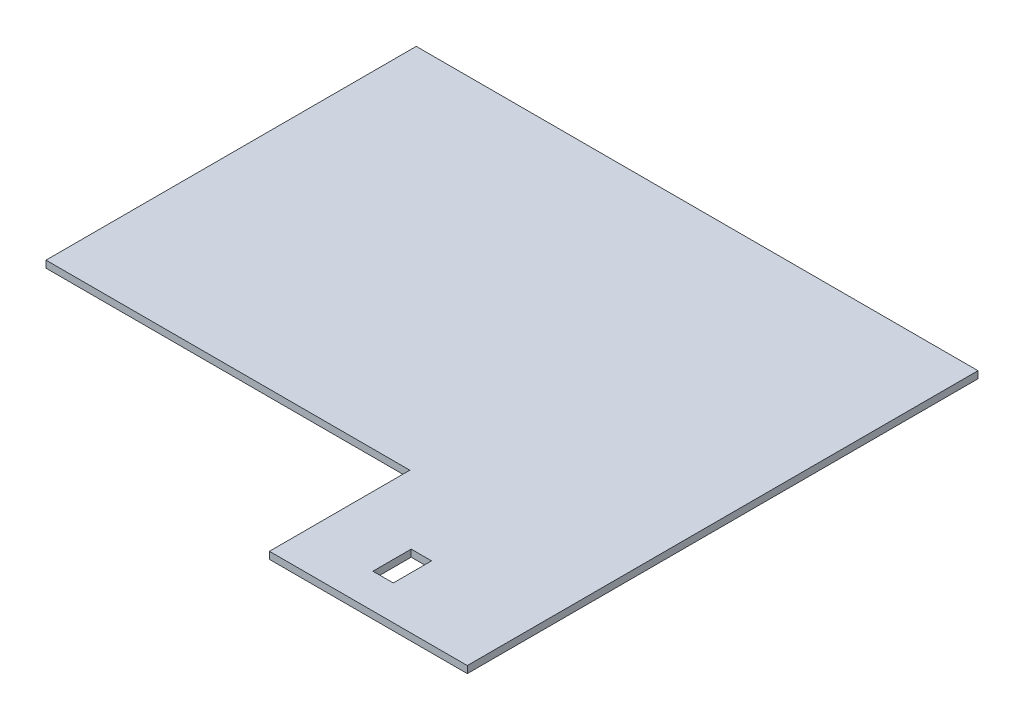
from build123d import *

# Parameters (mm, degrees)
CROQUIS1_W              = 15.961432879
CROQUIS1_H              = 30
SALIENTE_EXTRUIR1_DEPTH = 5.5


with BuildPart() as part:
    # Croquis1 → Saliente-Extruir1 (new body)
    with BuildSketch(Plane(origin=(0, 0, 0), x_dir=(-1, 0, 0), z_dir=(0, 1, 0))):
        Polygon((-73.586706802, 402.295789036), (-73.586706802, 292.295789036), (211.413293198, 292.295789036), (211.413293198, 2.295789036), (-228.586706802, 2.295789036), (-228.586706802, 402.295789036), (-143.586706802, 402.295789036), align=None)
        with Locations((-135.605990362, 360.295789036)):
            Rectangle(CROQUIS1_W, CROQUIS1_H, mode=Mode.SUBTRACT)
    extrude(amount=SALIENTE_EXTRUIR1_DEPTH)


solid = part.part
